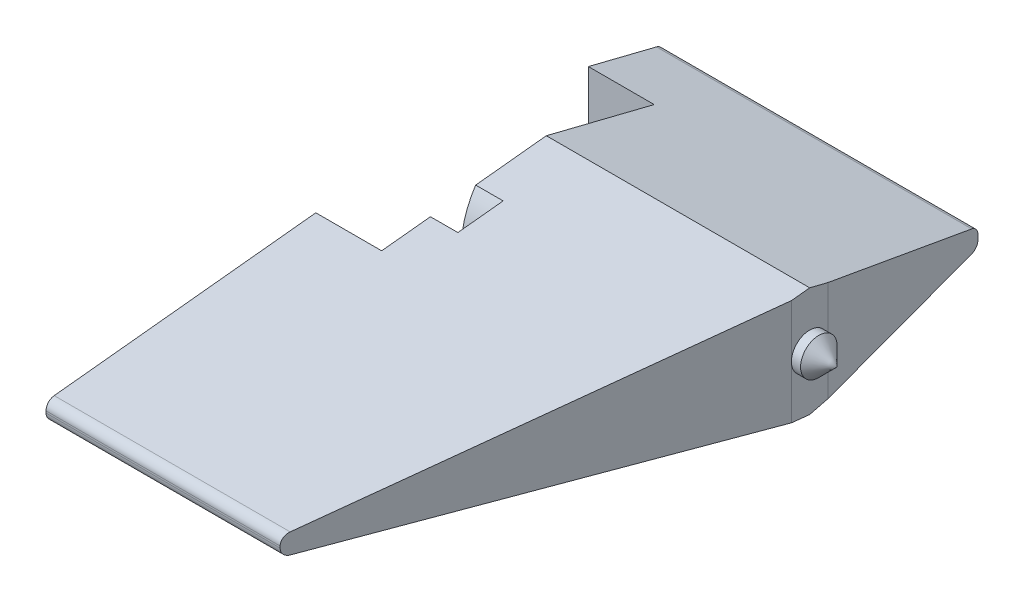
from build123d import *

# Parameters (mm, degrees)
SKETCH_1_3_R                  = 1.95
CUT_EXTRUDE_1_DEPTH           = 6.5
CUT_EXTRUDE_2_DEPTH           = 30.951001802
CUT_EXTRUDE_2_DEPTH_BACK      = 30.951001802
SKETCH_4_W                    = 3.6
SKETCH_4_H                    = 14.9
SKETCH_5_W                    = 1.5
SKETCH_5_H                    = 2.1
CUT_REVOLVE_1_ANGLE           = 40
CUT_REVOLVE_1_OTHER_WAY_ANGLE = 40
SKETCH_3_3_R                  = 1
EXTRUDE_1_DEPTH               = 1.5
CHAMFER_1_SIZE                = 1
CUT_EXTRUDE_3_DEPTH           = 31.875759187
CUT_EXTRUDE_3_DEPTH_BACK      = 31.875759187
FILLET_1_R                    = 0.5


with BuildPart() as part:
    # Эскиз1 → По сечениям1 section 0
    with BuildSketch(Plane(origin=(0, 0, 0), x_dir=(0, 0, -1), z_dir=(1, 0, 0))):
        with BuildLine():
            Line((-23.75, -0.5), (-23.75, 0.5))
            Line((-23.75, 0.5), (0, 3))
            Line((0, 3), (10, 0.5))
            Line((10, 0.5), (10, -0.5))
            Line((10, -0.5), (0, -3))
            Line((0, -3), (-23.75, -0.5))
        make_face()
    # Эскиз3 → По сечениям1 section 1
    with BuildSketch(Plane(origin=(18, 0, 0), x_dir=(0, 0, -1), z_dir=(1, 0, 0))):
        with BuildLine():
            Line((0, 3), (10, 0.5))
            Line((10, 0.5), (10, -0.5))
            Line((10, -0.5), (0, -3))
            Line((0, -3), (-23.75, -0.5))
            Line((-23.75, -0.5), (-23.75, 0.5))
            Line((-23.75, 0.5), (0, 3))
        make_face()
    loft()

    # Эскиз1<3> → Вырез-Вытянуть1 (cut)
    with BuildSketch(Plane(origin=(0, 0, 0), x_dir=(0, 0, -1), z_dir=(1, 0, 0))):
        with Locations(Location((0, 0, 0), (0, 0, 180))):
            Circle(SKETCH_1_3_R)
    extrude(amount=CUT_EXTRUDE_1_DEPTH, mode=Mode.SUBTRACT)

    # Эскиз4 → Вырез-Вытянуть2 (cut, two sides: drawn at the far end of the back side and taken through both)
    with BuildSketch(Plane(origin=(0, 0, 0), x_dir=(1, 0, 0), z_dir=(0, 1, 0)).offset(-CUT_EXTRUDE_2_DEPTH_BACK)):
        with Locations((1.8, -1.55)):
            Rectangle(SKETCH_4_W, SKETCH_4_H)
    extrude(amount=CUT_EXTRUDE_2_DEPTH + CUT_EXTRUDE_2_DEPTH_BACK, mode=Mode.SUBTRACT)

    # Эскиз5 → Вырез-Повернуть1 (revolve, cut)
    with BuildSketch(Plane(origin=(0, 0, 0), x_dir=(1, 0, 0), z_dir=(0, 1, 0))):
        with Locations((4.35, -5.7)):
            Rectangle(SKETCH_5_W, SKETCH_5_H)
    revolve(axis=Axis((6.5, 0, 0), (-1, 0, 0)), revolution_arc=CUT_REVOLVE_1_ANGLE, mode=Mode.SUBTRACT)

    # Эскиз5 → Вырез-Повернуть1 other way (revolve, cut)
    with BuildSketch(Plane(origin=(0, 0, 0), x_dir=(1, 0, 0), z_dir=(0, 1, 0))):
        with Locations((4.35, -5.7)):
            Rectangle(SKETCH_5_W, SKETCH_5_H)
    revolve(axis=Axis((6.5, 0, 0), (1, 0, 0)), revolution_arc=CUT_REVOLVE_1_OTHER_WAY_ANGLE, mode=Mode.SUBTRACT)

    # Эскиз3<3> → Бобышка-Вытянуть1 (add)
    with BuildSketch(Plane(origin=(18, 0, 0), x_dir=(0, 0, -1), z_dir=(1, 0, 0))):
        with Locations(Location((0, 0, 0), (0, 0, 180))):
            Circle(SKETCH_3_3_R)
    extrude(amount=EXTRUDE_1_DEPTH)

    # Фаска1
    chamfer_1_edges = [part.edges().sort_by_distance(p)[0] for p in [
        (19.5, 0, -1),
    ]]
    chamfer(chamfer_1_edges, length=CHAMFER_1_SIZE)

    # Эскиз6 → Вырез-Вытянуть3 (cut, two sides: drawn at the far end of the back side and taken through both)
    with BuildSketch(Plane(origin=(0, 0, 0), x_dir=(1, 0, 0), z_dir=(0, 1, 0)).offset(-CUT_EXTRUDE_3_DEPTH_BACK)):
        Polygon((18, 10), (17.2, 10), (18, 1), align=None)
        Polygon((12.8, -23.75), (18, -23.75), (18, -1), align=None)
    extrude(amount=CUT_EXTRUDE_3_DEPTH + CUT_EXTRUDE_3_DEPTH_BACK, mode=Mode.SUBTRACT)

    # Скругление1
    fillet_1_edges = [part.edges().sort_by_distance(p)[0] for p in [
        (6.4, 0.5, 23.75),
        (6.4, -0.5, 23.75),
        (8.6, 0.5, -10),
        (8.6, -0.5, -10),
    ]]
    fillet(fillet_1_edges, radius=FILLET_1_R)


solid = part.part
